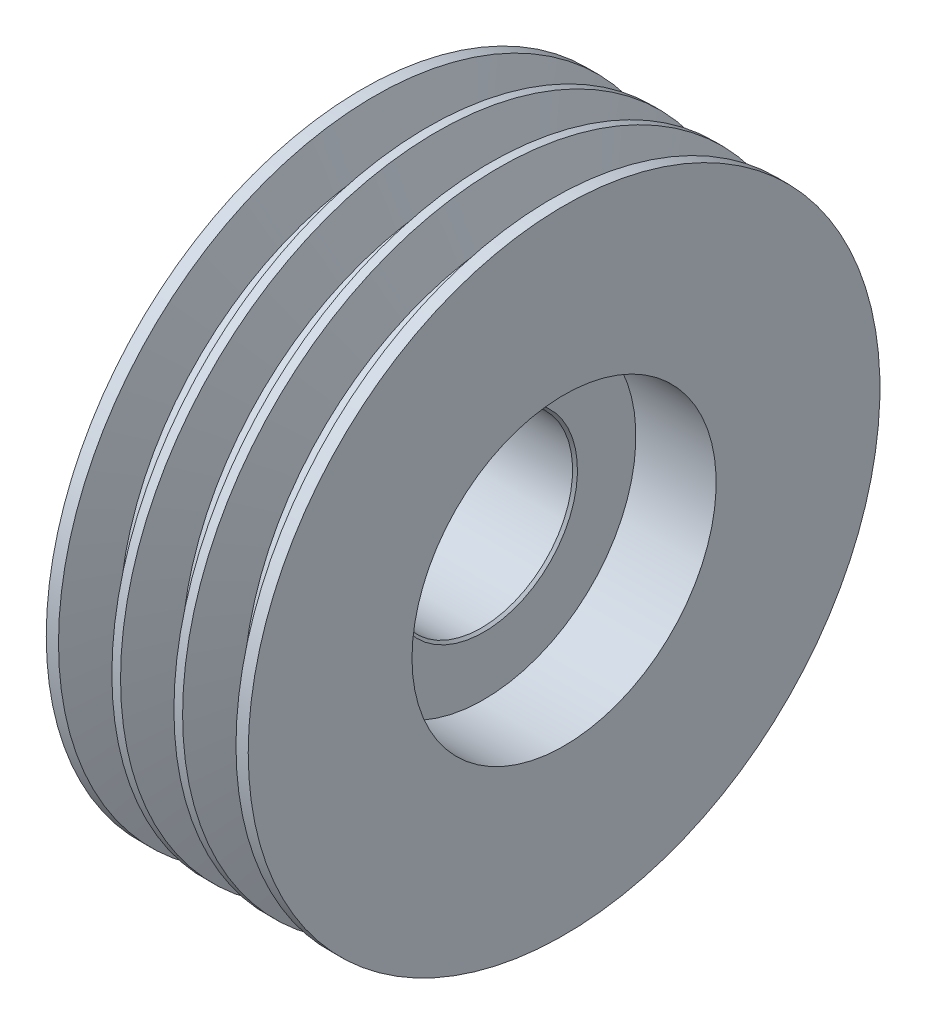
from build123d import *

# Parameters (mm, degrees)
PATTERN_LINEAR_1_COUNT = 3
PATTERN_LINEAR_1_PITCH = 25.5
CHAMFER_1_SIZE         = 1
SKETCH_4_W             = 20
SKETCH_4_H             = 6.257919358
CUT_EXTRUDE_1_DEPTH    = 202.457390036


with BuildPart() as part:
    # 草图1 → 旋转1 (revolve)
    with BuildSketch(Plane.XY, mode=Mode.PRIVATE) as revolve_1_sk:
        Polygon((0, 37.5), (0, 129.8), (83, 129.8), (83, 62.5), (50, 62.5), (50, 37.5), align=None)
    revolve(revolve_1_sk.sketch.rotate(Axis((0, 0, 0), (1, 0, 0)), 90), axis=Axis((0, 0, 0), (1, 0, 0)))

    # 草图2 → 切除-旋转1 (revolve, cut)
    with BuildSketch(Plane.XY, mode=Mode.PRIVATE) as cut_revolve_1_sk:
        Polygon((21.128051255, 110.7), (26.967507271, 129.8), (5.032492729, 129.8), (10.871948745, 110.7), align=None)
    cut_revolve_1 = revolve(cut_revolve_1_sk.sketch.rotate(Axis((0, 0, 0), (1, 0, 0)), 90), axis=Axis((0, 0, 0), (1, 0, 0)), mode=Mode.SUBTRACT)

    # 阵列(线性)1: 切除-旋转1 ×3
    with Locations(*[(i * PATTERN_LINEAR_1_PITCH, 0, 0) for i in range(1, PATTERN_LINEAR_1_COUNT)]):
        add(cut_revolve_1, mode=Mode.SUBTRACT)

    # 倒角1
    chamfer_1_edges = [part.edges().sort_by_distance(p)[0] for p in [
        (0, 0, -37.5),
        (50, 0, -37.5),
    ]]
    chamfer(chamfer_1_edges, length=CHAMFER_1_SIZE)

    # 草图4 → 切除-拉伸1 (cut, through all)
    with BuildSketch(Plane.ZY):
        with Locations((0, 39.271040416)):
            Rectangle(SKETCH_4_W, SKETCH_4_H)
    extrude(amount=-CUT_EXTRUDE_1_DEPTH, mode=Mode.SUBTRACT)


solid = part.part
